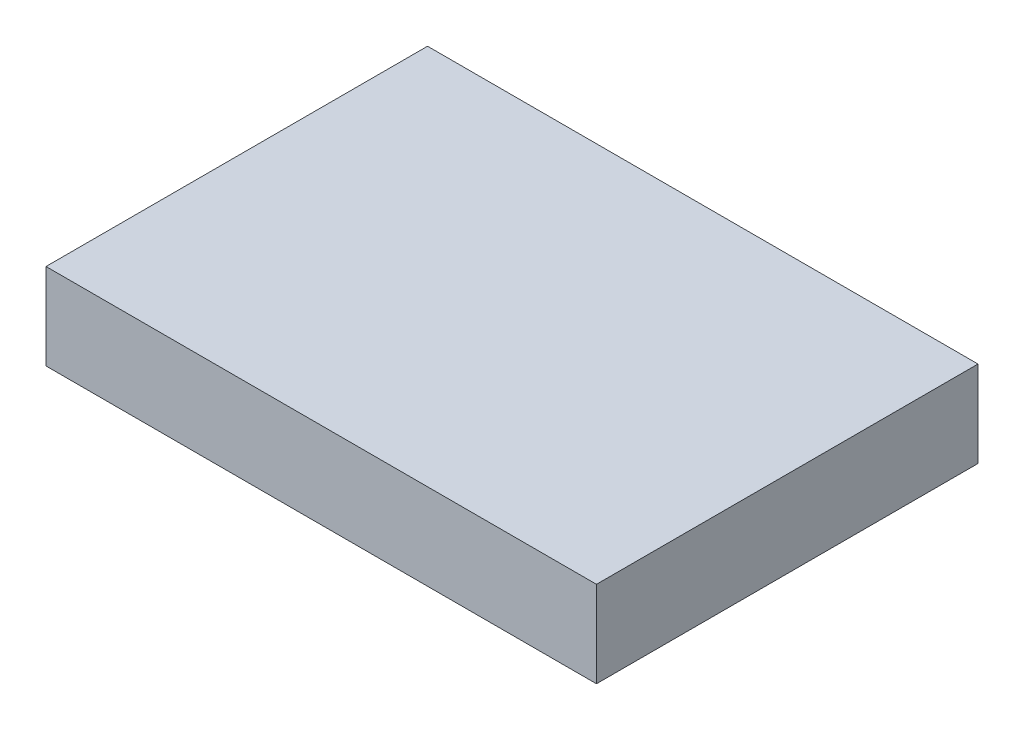
from build123d import *

# Parameters (mm, degrees)
SKETCH1_W           = 13.415822062
SKETCH1_H           = 9.298797302
BOSS_EXTRUDE1_DEPTH = 2.1


with BuildPart() as part:
    # Sketch1 → Boss-Extrude1 (new body)
    with BuildSketch(Plane(origin=(0, 0, 0), x_dir=(1, 0, 0), z_dir=(0, 1, 0))):
        with Locations((-5.602814139, -15.480572603)):
            Rectangle(SKETCH1_W, SKETCH1_H)
    extrude(amount=BOSS_EXTRUDE1_DEPTH)


solid = part.part
